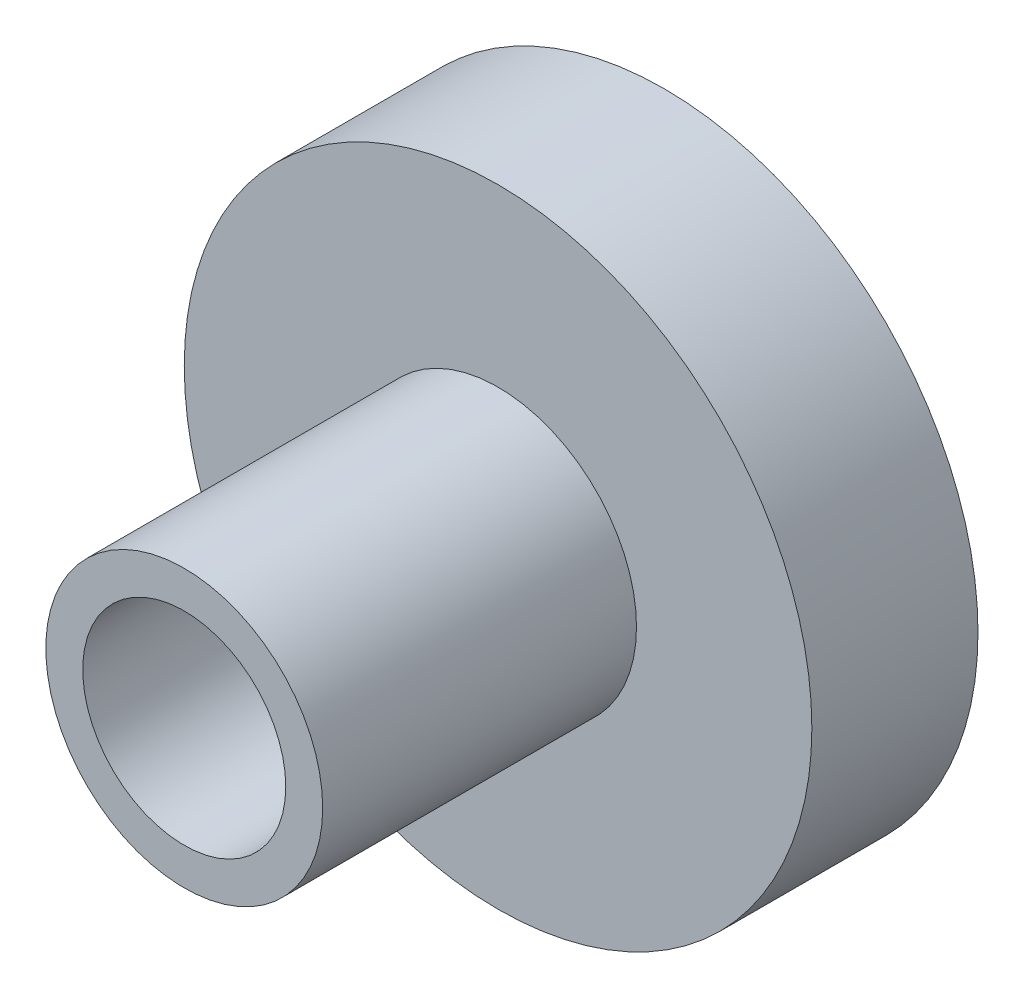
from build123d import *


with BuildPart() as part:
    # Эскиз1 → Повернуть1 (revolve)
    with BuildSketch(Plane(origin=(0, 0, 0), x_dir=(1, 0, 0), z_dir=(0, 1, 0))):
        Polygon((2.75, -13), (3.75, -13), (3.75, -4.5), (8.5, -4.5), (8.5, 0), (2.75, 0), align=None)
    revolve(axis=Axis((0, 0, 0), (0, 0, 1)))


solid = part.part
